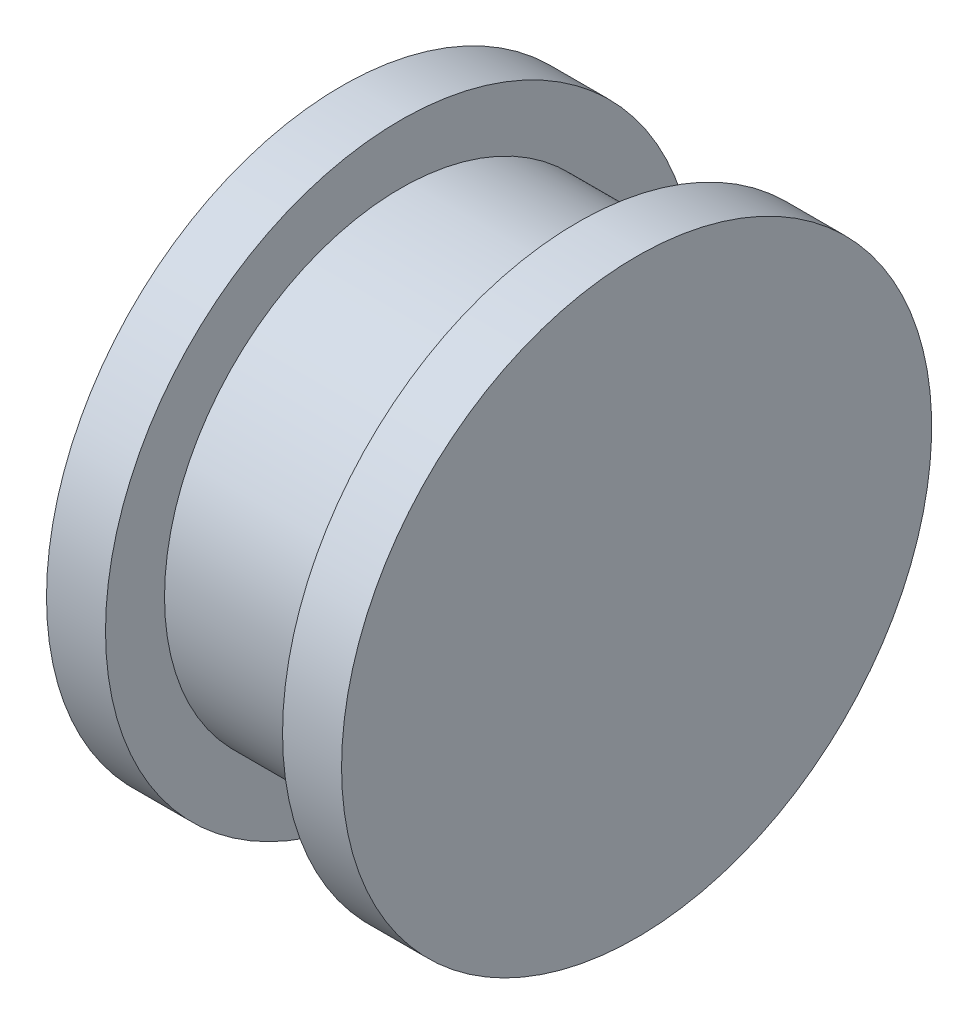
from build123d import *


with BuildPart() as part:
    # Esquisse1 → Révolution1 (revolve)
    with BuildSketch(Plane.XY, mode=Mode.PRIVATE) as r_volution1_sk:
        Polygon((-4, -5), (-4, -4), (-1, -4), (-1, -5), (0, -5), (0, 0), (-1, 0), (-1, -3), (-5, -3), (-5, -5), align=None)
    revolve(r_volution1_sk.sketch.rotate(Axis((0, 0, 0), (1, 0, 0)), 270), axis=Axis((0, 0, 0), (1, 0, 0)))


solid = part.part
